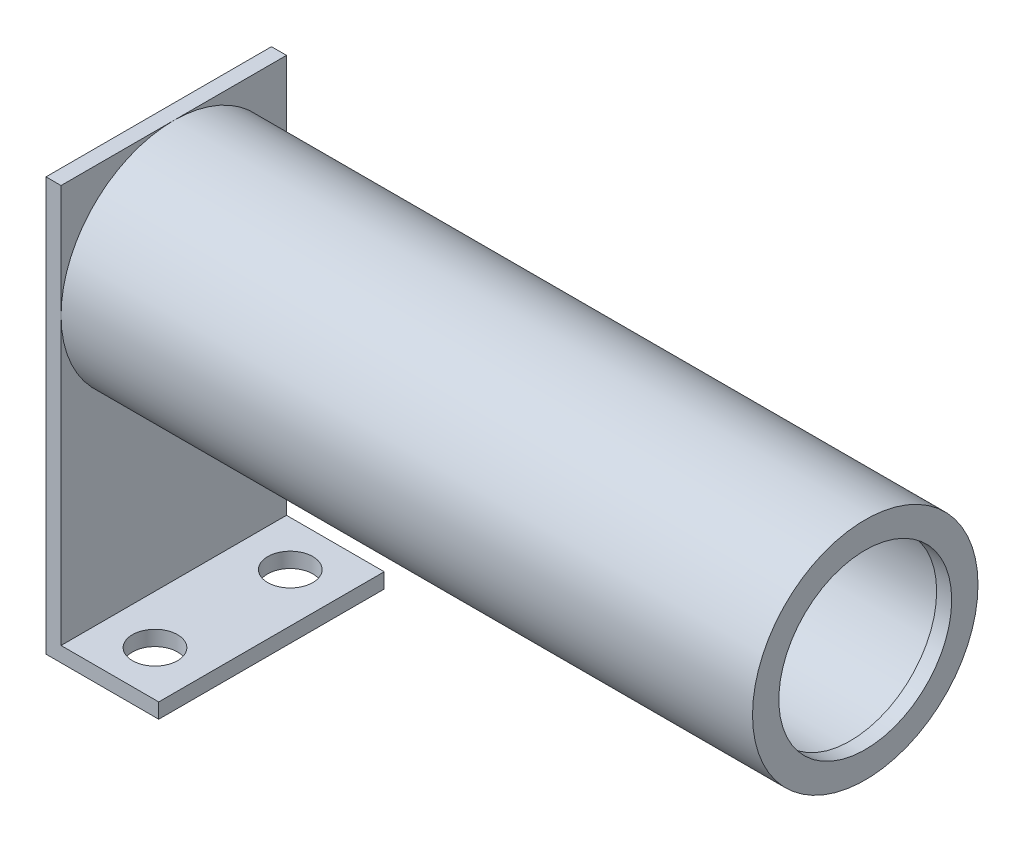
from build123d import *

# Parameters (mm, degrees)
SKETCH1_W           = 15
SKETCH1_H           = 30
BOSS_EXTRUDE1_DEPTH = 2
SKETCH2_W           = 2
SKETCH2_H           = 30
BOSS_EXTRUDE2_DEPTH = 53
SKETCH3_R           = 15
SKETCH3_R_2         = 12.5
BOSS_EXTRUDE3_DEPTH = 92
BOSS_EXTRUDE4_START = -2
SKETCH4_R           = 12.5
SKETCH4_R_2         = 11.5
BOSS_EXTRUDE4_DEPTH = 2
SKETCH7_R           = 3
CUT_EXTRUDE1_DEPTH  = 10


with BuildPart() as part:
    # Sketch1 → Boss-Extrude1 (new body)
    with BuildSketch(Plane(origin=(0, 0, 0), x_dir=(1, 0, 0), z_dir=(0, 1, 0))):
        Rectangle(SKETCH1_W, SKETCH1_H)
    extrude(amount=BOSS_EXTRUDE1_DEPTH)

    # Sketch2 → Boss-Extrude2 (add)
    with BuildSketch(Plane(origin=(0, 2, 0), x_dir=(1, 0, 0), z_dir=(0, 1, 0))):
        with Locations((-6.5, 0)):
            Rectangle(SKETCH2_W, SKETCH2_H)
    extrude(amount=BOSS_EXTRUDE2_DEPTH)

    # Sketch3 → Boss-Extrude3 (add)
    with BuildSketch(Plane(origin=(-5.5, 0, 0), x_dir=(0, 0, -1), z_dir=(1, 0, 0))):
        with Locations((0, 40)):
            Circle(SKETCH3_R)
        with Locations((0, 40)):
            Circle(SKETCH3_R_2, mode=Mode.SUBTRACT)
    extrude(amount=BOSS_EXTRUDE3_DEPTH)

    # Sketch4 → Boss-Extrude4 (add)
    with BuildSketch(Plane(origin=(86.5, 0, 0), x_dir=(0, 0, -1), z_dir=(1, 0, 0)).offset(BOSS_EXTRUDE4_START)):
        with Locations((0, 40)):
            Circle(SKETCH4_R)
        with Locations((0, 40)):
            Circle(SKETCH4_R_2, mode=Mode.SUBTRACT)
    extrude(amount=BOSS_EXTRUDE4_DEPTH)

    # Sketch7 → Cut-Extrude1 (cut)
    with BuildSketch(Plane(origin=(0, 2, 0), x_dir=(1, 0, 0), z_dir=(0, 1, 0))):
        with Locations(Location((1, -9, 0), (0, 0, 270))):
            Circle(SKETCH7_R)
        with Locations(Location((1, 9, 0), (0, 0, 270))):
            Circle(SKETCH7_R)
    extrude(amount=-CUT_EXTRUDE1_DEPTH, mode=Mode.SUBTRACT)


solid = part.part
